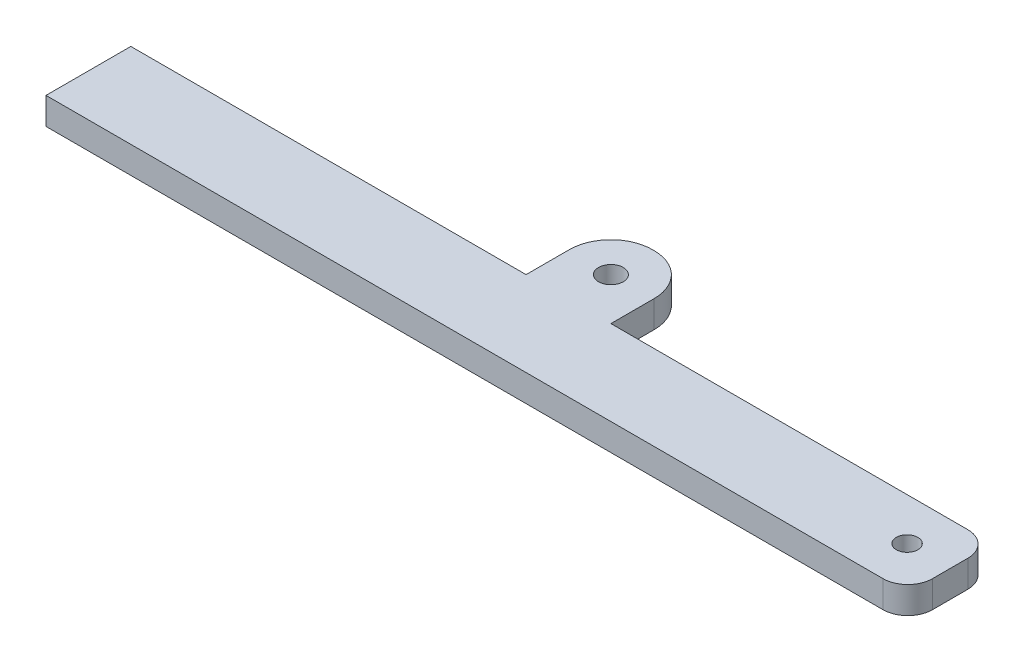
from build123d import *

# Parameters (mm, degrees)
SKETCH1_R           = 1.4605
SKETCH1_R_2         = 1.27
BOSS_EXTRUDE1_DEPTH = 3.175
FILLET1_R           = 2.921


with BuildPart() as part:
    # Sketch1 → Boss-Extrude1 (new body)
    with BuildSketch(Plane(origin=(0, 0, 0), x_dir=(1, 0, 0), z_dir=(0, 1, 0))):
        with BuildLine():
            Line((56.6, 10), (101.6, 10))
            Line((101.6, 10), (101.6, 0))
            Line((101.6, 0), (0, 0))
            Line((0, 0), (0, 10))
            Line((0, 10), (46.6, 10))
            Line((46.6, 10), (46.6, 15.1))
            ThreePointArc((46.6, 15.1), (48.035176772, 18.564823228), (51.5, 20))
            Line((51.5, 20), (51.7, 20))
            ThreePointArc((51.7, 20), (55.164823228, 18.564823228), (56.6, 15.1))
            Line((56.6, 15.1), (56.6, 10))
        make_face()
        with Locations(Location((51.6, 15, 0), (0, 0, 270))):
            Circle(SKETCH1_R, mode=Mode.SUBTRACT)
        with Locations(Location((96.52, 5, 0), (0, 0, 270))):
            Circle(SKETCH1_R_2, mode=Mode.SUBTRACT)
    extrude(amount=BOSS_EXTRUDE1_DEPTH)

    # Fillet1
    fillet1_edges = [part.edges().sort_by_distance(p)[0] for p in [
        (101.6, 1.5875, -10),
        (101.6, 1.5875, 0),
    ]]
    fillet(fillet1_edges, radius=FILLET1_R)


solid = part.part
